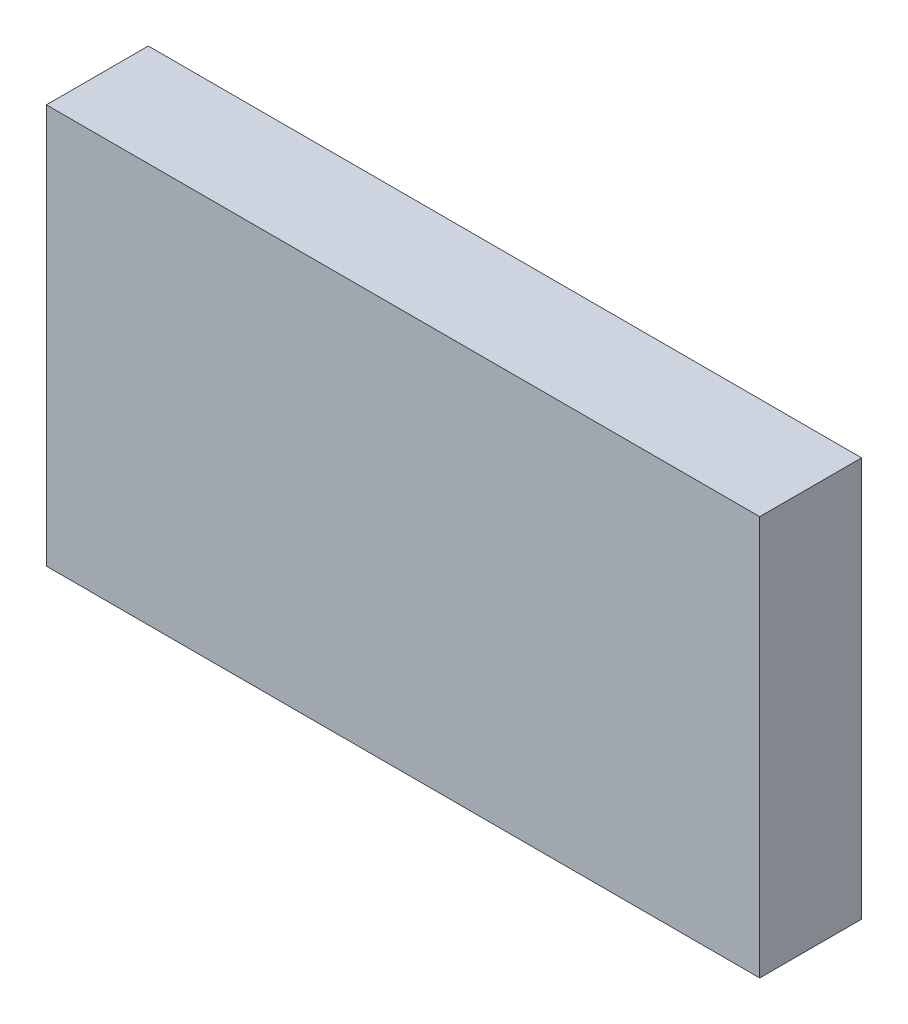
from build123d import *

# Parameters (mm, degrees)
IZIM1_W                     = 70.022462904
IZIM1_H                     = 39.220588235
Y_KSEKLIK_EKSTR_ZYON1_DEPTH = 10


with BuildPart() as part:
    # Çizim1 → Yükseklik-Ekstrüzyon1 (new body)
    with BuildSketch(Plane.XY):
        with Locations((35.011231452, -19.610294118)):
            Rectangle(IZIM1_W, IZIM1_H)
    extrude(amount=Y_KSEKLIK_EKSTR_ZYON1_DEPTH)


solid = part.part
